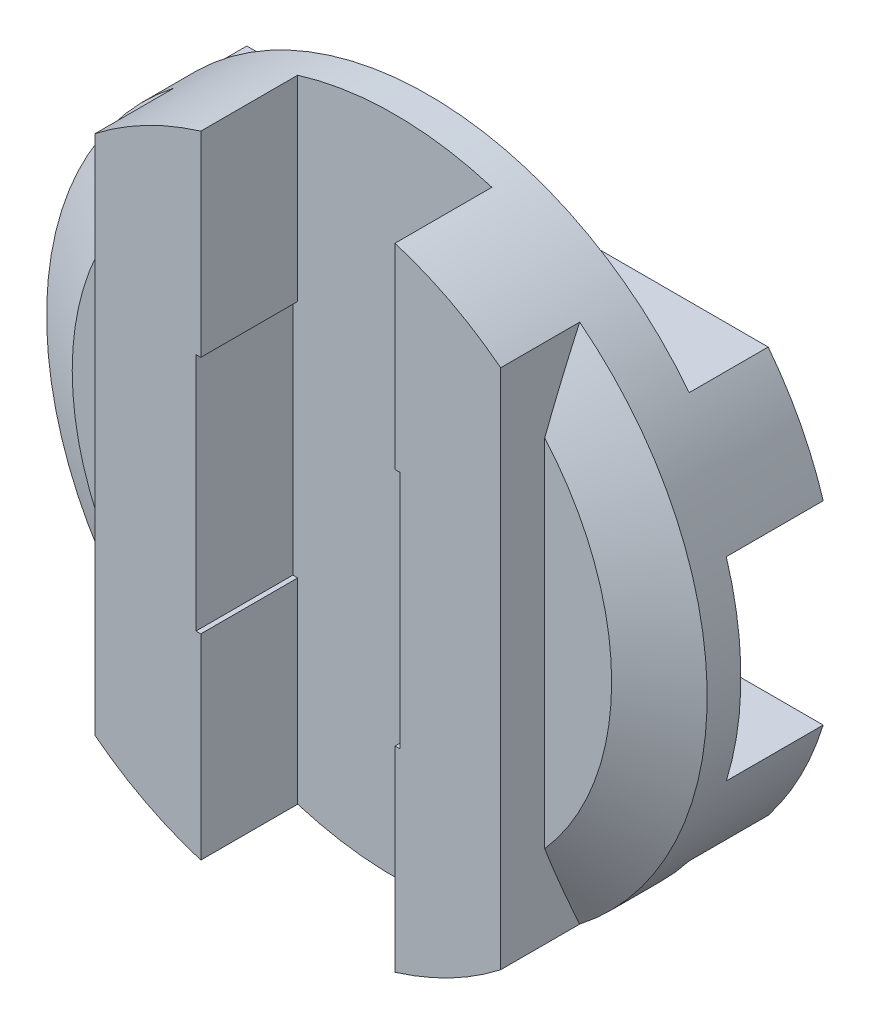
from build123d import *
from OCP.BRepFilletAPI import BRepFilletAPI_MakeChamfer

# Parameters (mm, degrees)
SKETCH1_R           = 9.525
BOSS_EXTRUDE1_DEPTH = 3.0226
SKETCH2_W           = 5.6007
SKETCH2_H           = 19.05
CUT_EXTRUDE1_DEPTH  = 2.794
SKETCH3_W           = 19.05
SKETCH3_H           = 5.6007
CUT_EXTRUDE2_DEPTH  = 2.794
SKETCH4_W           = 3.67665
SKETCH4_H           = 19.05
CUT_EXTRUDE3_DEPTH  = 1.27
SKETCH5_W           = 19.05
SKETCH5_H           = 3.67665
CUT_EXTRUDE4_DEPTH  = 1.27
CHAMFER1_SIZE       = 1.74640875
CHAMFER1_SIZE2      = 1.008289562
SKETCH6_W           = 5.880735
SKETCH6_H           = 6.905625
CUT_EXTRUDE5_DEPTH  = 2.794
SKETCH7_W           = 6.905625
SKETCH7_H           = 5.880735
CUT_EXTRUDE6_DEPTH  = 2.794


with BuildPart() as part:
    # Sketch1 → Boss-Extrude1 (new, symmetric)
    with BuildSketch(Plane.XY):
        Circle(SKETCH1_R)
    extrude(amount=BOSS_EXTRUDE1_DEPTH, both=True)

    # Sketch2 → Cut-Extrude1 (cut)
    with BuildSketch(Plane.XY.offset(3.0226)):
        Rectangle(SKETCH2_W, SKETCH2_H)
    extrude(amount=-CUT_EXTRUDE1_DEPTH, mode=Mode.SUBTRACT)

    # Sketch3 → Cut-Extrude2 (cut)
    with BuildSketch(Plane(origin=(0, 0, -3.0226), x_dir=(-1, 0, 0), z_dir=(0, 0, -1))):
        Rectangle(SKETCH3_W, SKETCH3_H)
    extrude(amount=-CUT_EXTRUDE2_DEPTH, mode=Mode.SUBTRACT)

    # Sketch4 → Cut-Extrude3 (cut)
    with BuildSketch(Plane.XY.offset(3.0226)):
        with Locations((7.686675, 0)):
            Rectangle(SKETCH4_W, SKETCH4_H)
        with Locations((-7.686675, 0)):
            Rectangle(SKETCH4_W, SKETCH4_H)
    extrude(amount=-CUT_EXTRUDE3_DEPTH, mode=Mode.SUBTRACT)

    # Sketch5 → Cut-Extrude4 (cut)
    with BuildSketch(Plane(origin=(0, 0, -3.0226), x_dir=(-1, 0, 0), z_dir=(0, 0, -1))):
        with Locations((0, 7.686675)):
            Rectangle(SKETCH5_W, SKETCH5_H)
        with Locations((0, -7.686675)):
            Rectangle(SKETCH5_W, SKETCH5_H)
    extrude(amount=-CUT_EXTRUDE4_DEPTH, mode=Mode.SUBTRACT)

    # Chamfer1: one chamfer whose edges measure the first distance from different faces: ONE call of the kernel's chamfer builder (chamfer() names one face for all edges)
    chamfer1_edges_1 = [part.edges().sort_by_distance(p)[0] for p in [
        (0, 9.525, -1.7526),
    ]]
    chamfer1_side_1 = [part.faces().sort_by_distance(p)[0] for p in [
        (0, 7.346425268, -1.7526),
    ]]
    chamfer1_edges_2 = [part.edges().sort_by_distance(p)[0] for p in [
        (0, -9.525, -1.7526),
    ]]
    chamfer1_side_2 = [part.faces().sort_by_distance(p)[0] for p in [
        (0, -7.346425268, -1.7526),
    ]]
    chamfer1_edges_3 = [part.edges().sort_by_distance(p)[0] for p in [
        (8.556610274, 4.184500642, 1.7526),
    ]]
    chamfer1_side_3 = [part.faces().sort_by_distance(p)[0] for p in [
        (7.346425268, 0, 1.7526),
    ]]
    chamfer1_edges_4 = [part.edges().sort_by_distance(p)[0] for p in [
        (-9.525, 0, 1.7526),
    ]]
    chamfer1_side_4 = [part.faces().sort_by_distance(p)[0] for p in [
        (-7.346425268, 0, 1.7526),
    ]]
    chamfer1 = BRepFilletAPI_MakeChamfer(part.part.solid().wrapped)
    for e in chamfer1_edges_1:
        chamfer1.Add(CHAMFER1_SIZE, CHAMFER1_SIZE2, e.wrapped, chamfer1_side_1[0].wrapped)  # the first distance lies on this face
    for e in chamfer1_edges_2:
        chamfer1.Add(CHAMFER1_SIZE, CHAMFER1_SIZE2, e.wrapped, chamfer1_side_2[0].wrapped)  # the first distance lies on this face
    for e in chamfer1_edges_3:
        chamfer1.Add(CHAMFER1_SIZE, CHAMFER1_SIZE2, e.wrapped, chamfer1_side_3[0].wrapped)  # the first distance lies on this face
    for e in chamfer1_edges_4:
        chamfer1.Add(CHAMFER1_SIZE, CHAMFER1_SIZE2, e.wrapped, chamfer1_side_4[0].wrapped)  # the first distance lies on this face
    add(Compound.cast(chamfer1.Shape()), mode=Mode.REPLACE)

    # Sketch6 → Cut-Extrude5 (cut)
    with BuildSketch(Plane.XY.offset(3.0226)):
        Rectangle(SKETCH6_W, SKETCH6_H)
    extrude(amount=-CUT_EXTRUDE5_DEPTH, mode=Mode.SUBTRACT)

    # Sketch7 → Cut-Extrude6 (cut)
    with BuildSketch(Plane(origin=(0, 0, -3.0226), x_dir=(-1, 0, 0), z_dir=(0, 0, -1))):
        Rectangle(SKETCH7_W, SKETCH7_H)
    extrude(amount=-CUT_EXTRUDE6_DEPTH, mode=Mode.SUBTRACT)


solid = part.part
